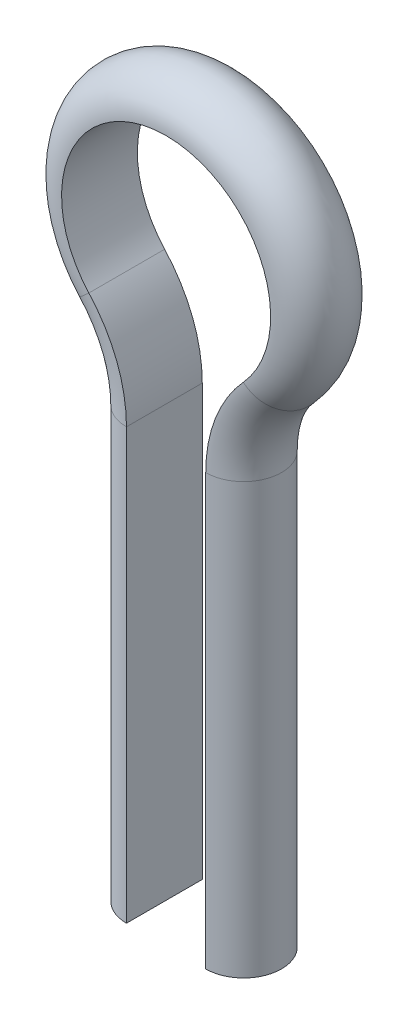
from build123d import *


with BuildPart() as part:
    # Sweep3: sweep along a path in Sketch1
    with BuildLine(Plane.XY) as sweep3_path:
        Line((0, 0), (0, 58.71201163))
        ThreePointArc((0, 58.71201163), (1.013002382, 64.130858152), (3.91518635, 68.817797416))
        ThreePointArc((3.91518635, 68.817797416), (-10.093918683, 100.546755711), (-24.103023716, 68.817797416))
        ThreePointArc((-24.103023716, 68.817797416), (-21.200839748, 64.130858152), (-20.187837366, 58.71201163))
        Line((-20.187837366, 58.71201163), (-20.187837366, 0))
    # Sketch6 → Sweep3 (sweep)
    with BuildSketch(Plane(origin=(0, 0, 0), x_dir=(1, 0, 0), z_dir=(0, 1, 0))):
        with BuildLine():
            Line((-4.682133389, 5.294137788), (-4.682133389, -5.058842775))
            ThreePointArc((-4.682133389, -5.058842775), (0.494356893, 0.117647506), (-4.682133389, 5.294137788))
        make_face()
    sweep(path=sweep3_path.line)


solid = part.part
